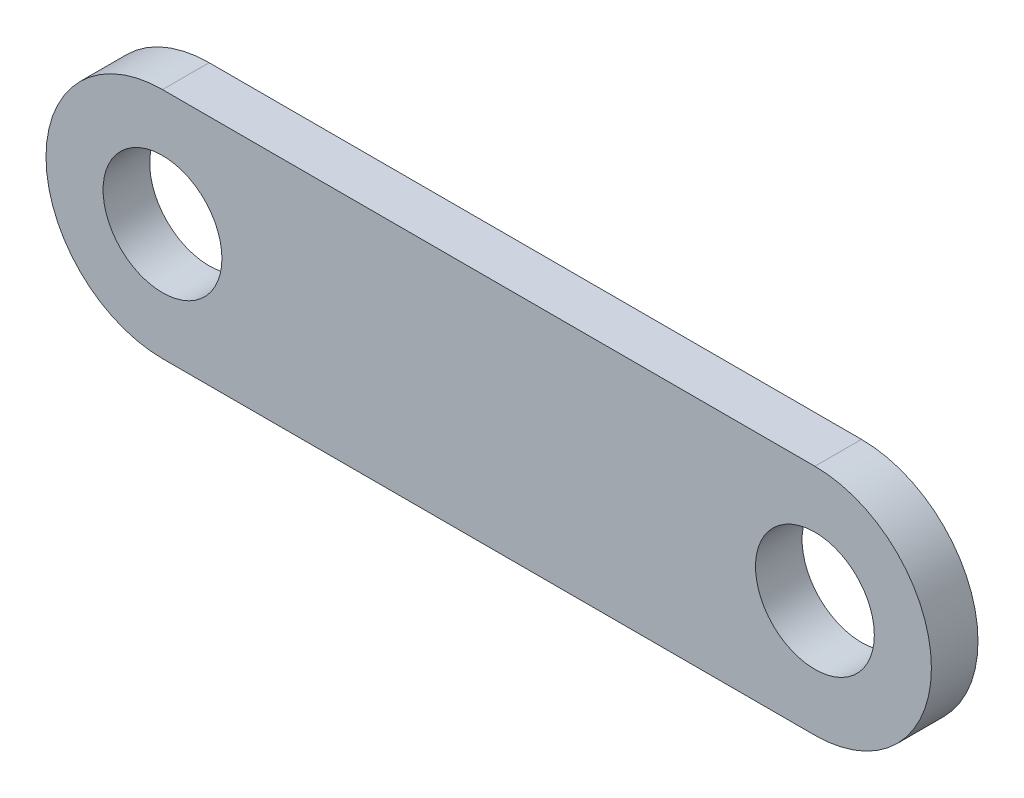
from build123d import *

# Parameters (mm, degrees)
SKETCH_1_R      = 2.55
EXTRUDE_1_DEPTH = 2


with BuildPart() as part:
    # 草图1 → 凸台-拉伸1 (new body)
    with BuildSketch(Plane.XY):
        with BuildLine():
            Line((-14, 5), (14, 5))
            ThreePointArc((14, 5), (19, 0), (14, -5))
            Line((14, -5), (-14, -5))
            ThreePointArc((-14, -5), (-19, 0), (-14, 5))
        make_face()
        with Locations((-14, 0)):
            Circle(SKETCH_1_R, mode=Mode.SUBTRACT)
        with Locations((14, 0)):
            Circle(SKETCH_1_R, mode=Mode.SUBTRACT)
    extrude(amount=EXTRUDE_1_DEPTH)


solid = part.part
